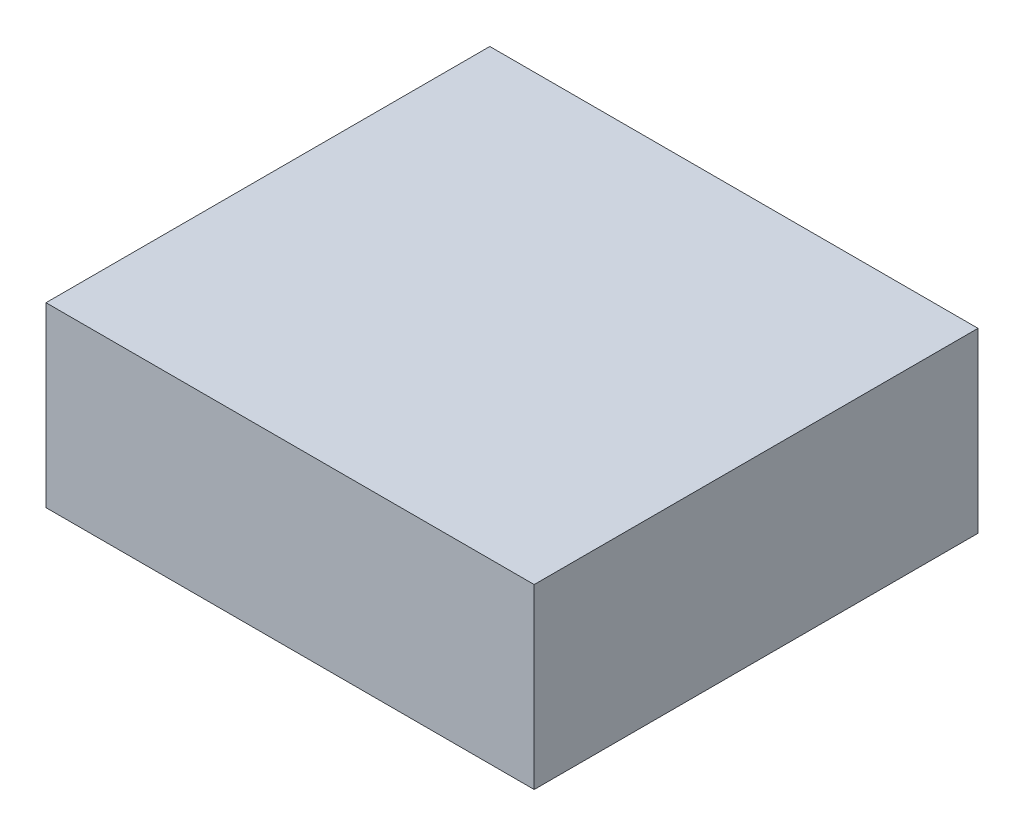
from build123d import *

# Parameters (mm, degrees)
SKETCH1_W           = 139.7
SKETCH1_H           = 127
BOSS_EXTRUDE1_DEPTH = 50.8


with BuildPart() as part:
    # Sketch1 → Boss-Extrude1 (new body)
    with BuildSketch(Plane(origin=(0, 0, 0), x_dir=(1, 0, 0), z_dir=(0, 1, 0))):
        Rectangle(SKETCH1_W, SKETCH1_H)
    extrude(amount=BOSS_EXTRUDE1_DEPTH)


solid = part.part
